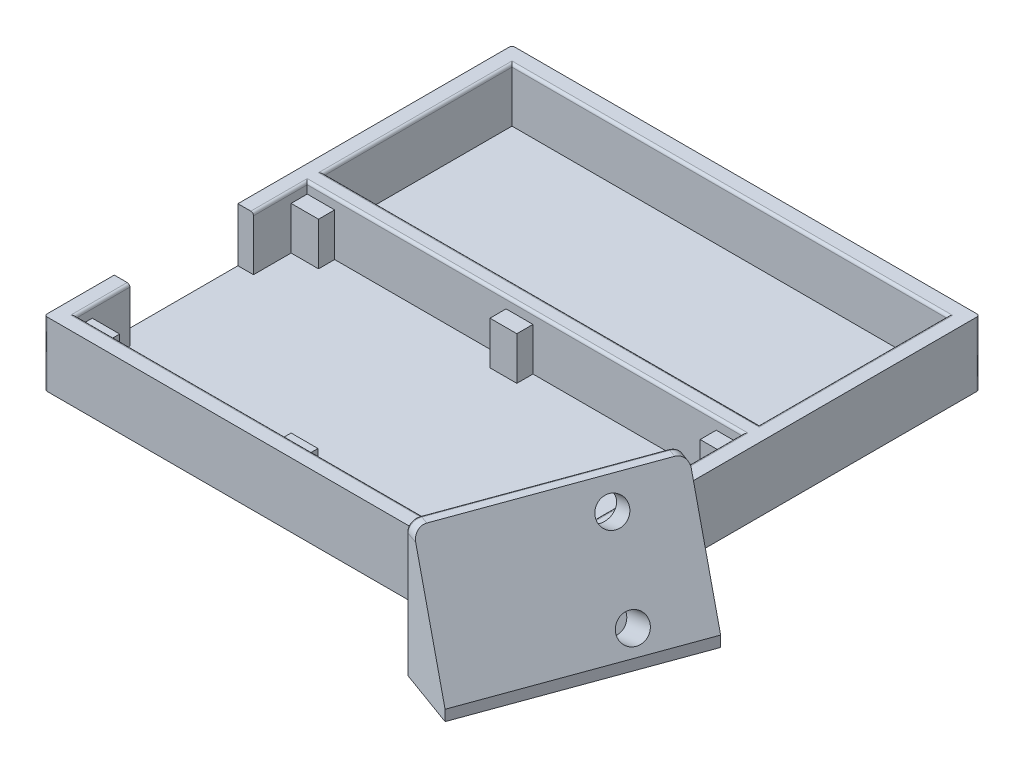
from build123d import *

# Parameters (mm, degrees)
BOSS_EXTRUDE1_DEPTH   = 40
BODY_MOVE_COPY1_ANGLE = 20
BOSS_EXTRUDE2_DEPTH   = 2
SKETCH1_4_W           = 81
SKETCH1_4_H           = 35
BOSS_EXTRUDE3_DEPTH   = 12
SKETCH4_R             = 2.5
CUT_EXTRUDE2_DEPTH    = 8
FILLET1_R             = 2
SKETCH10_W            = 4.9
SKETCH10_H            = 3
SKETCH10_W_2          = 5.1
SKETCH10_W_3          = 5
CUT_EXTRUDE4_DEPTH    = 2
FILLET2_R             = 0.5


with BuildPart() as part:
    # Sketch2 → Boss-Extrude1 (new body)
    with BuildSketch(Plane.XY):
        Polygon((90, 0), (102, 0), (102, 2), (92, 25), (90, 25), align=None)
    extrude(amount=BOSS_EXTRUDE1_DEPTH)


with BuildPart() as part_1:
    # Body-Move/Copy1: moved
    add(part.part.rotate(Axis((95, 0, 20), (0, -1, 0)), BODY_MOVE_COPY1_ANGLE))


with BuildPart() as part_2:
    # Body-Move/Copy2: moved
    add(part_1.part.moved(Location((-4, 0, -25))))

    # Sketch1 → Boss-Extrude2 (add)
    with BuildSketch(Plane(origin=(0, 0, 0), x_dir=(1, 0, 0), z_dir=(0, 1, 0))):
        Polygon((0, 0), (73, 0), (84, -12), (87, 0), (87, 87), (0, 87), align=None)
    extrude(amount=BOSS_EXTRUDE2_DEPTH)

    # Sketch1<4> → Boss-Extrude3 (add)
    with BuildSketch(Plane(origin=(0, 0, 0), x_dir=(1, 0, 0), z_dir=(0, 1, 0))):
        Polygon((8, 43), (8, 46), (39.9, 46), (39.9, 43), (44.9, 43), (44.9, 46), (79, 46), (79, 43), (83.9, 43), (83.9, 6), (79, 6), (79, 3), (44.9, 3), (44.9, 6), (39.9, 6), (39.9, 3), (8, 3), (8, 6), (2.9, 6), (2.9, 13), (0, 13), (0, 0), (87, 0), (87, 87), (0, 87), (0, 36), (2.9, 36), (2.9, 43), align=None)
        with Locations((43.5, 66.5)):
            Rectangle(SKETCH1_4_W, SKETCH1_4_H, mode=Mode.SUBTRACT)
    extrude(amount=BOSS_EXTRUDE3_DEPTH)

    # Sketch4 → Cut-Extrude2 (cut)
    with BuildSketch(Plane(origin=(72.447790922, 33.520577724, 26.368839434), x_dir=(0.30020671045987535, 0.09758957417323016, -0.948868908757974), z_dir=(0.8617639646050662, 0.3987261114144503, 0.31365643207890637))):
        with Locations(Location((42.044187921, -18.952687866, 0), (0, 0, 92.148700458))):
            Circle(SKETCH4_R)
        with Locations(Location((40.341555526, -34.861837527, 0), (0, 0, 92.148700458))):
            Circle(SKETCH4_R)
    extrude(amount=-CUT_EXTRUDE2_DEPTH, mode=Mode.SUBTRACT)

    # Fillet1
    fillet1_edges = [part_2.edges().sort_by_distance(p)[0] for p in [
        (80.40082665, 25, 12.425771842),
        (94.081632383, 25, -25.161932989),
    ]]
    fillet(fillet1_edges, radius=FILLET1_R)

    # Sketch10 → Cut-Extrude4 (cut)
    with BuildSketch(Plane(origin=(0, 12, 0), x_dir=(1, 0, 0), z_dir=(0, 1, 0))):
        with Locations((81.45, 4.5)):
            Rectangle(SKETCH10_W, SKETCH10_H)
        with Locations((42.45, 4.5)):
            Rectangle(SKETCH10_W_2, SKETCH10_H)
        with Locations((42.4, 44.5)):
            Rectangle(SKETCH10_W_3, SKETCH10_H)
        with Locations((81.45, 44.5)):
            Rectangle(SKETCH10_W, SKETCH10_H)
        with Locations((5.45, 44.5)):
            Rectangle(SKETCH10_W_2, SKETCH10_H)
        with Locations((5.45, 4.5)):
            Rectangle(SKETCH10_W_2, SKETCH10_H)
    extrude(amount=-CUT_EXTRUDE4_DEPTH, mode=Mode.SUBTRACT)

    # Fillet2
    fillet2_edges = [part_2.edges().sort_by_distance(p)[0] for p in [
        (43.4, 12, -3),
        (43.5, 12, -49),
        (86.301536896, 25, -6.710100717),
        (79.46113403, 11.5, 12.083751699),
        (93.141939763, 11.5, -25.503953132),
        (79.661484791, 24.414213562, 11.533292506),
        (92.941589001, 24.414213562, -24.95349394),
        (87, 6, -87),
        (0, 6, -87),
        (0, 6, 0),
        (3, 12, -66.5),
        (43.5, 12, -84),
        (84, 12, -66.5),
        (2.9, 12, -41),
        (43.4, 12, -46),
        (83.9, 12, -24.5),
        (2.9, 12, -8),
    ]]
    fillet(fillet2_edges, radius=FILLET2_R)


solid = part_2.part
